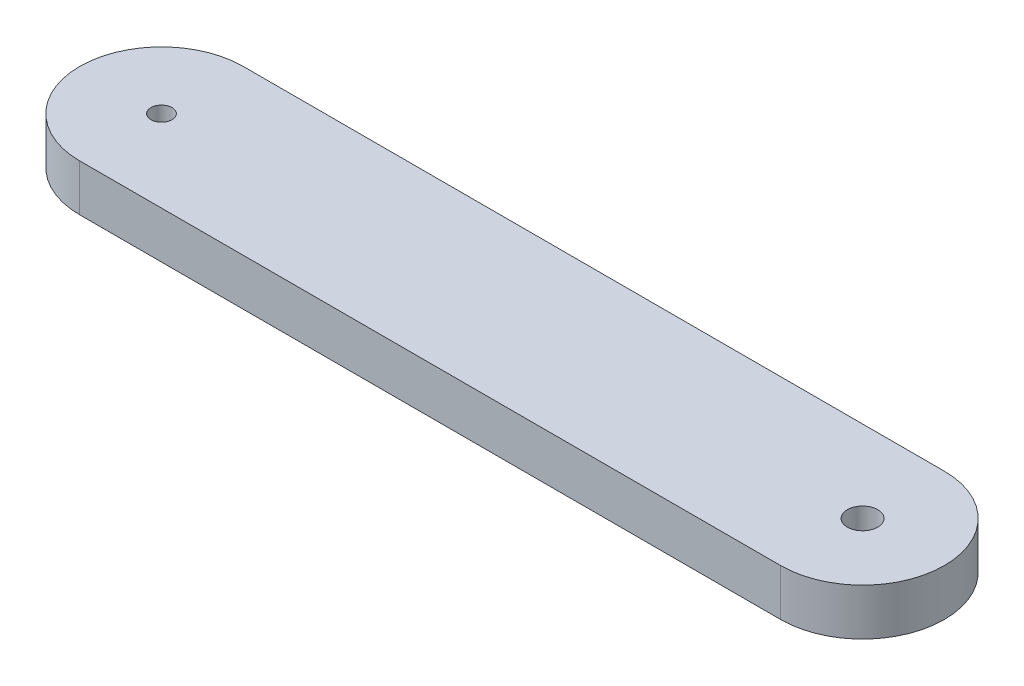
from build123d import *

# Parameters (mm, degrees)
SKETCH1_R           = 2.25
SKETCH1_R_2         = 3.25
BOSS_EXTRUDE1_DEPTH = 10


with BuildPart() as part:
    # Sketch1 → Boss-Extrude1 (new body)
    with BuildSketch(Plane(origin=(0, 0, 0), x_dir=(1, 0, 0), z_dir=(0, 1, 0))):
        with BuildLine():
            Line((0, 17.5), (150, 17.5))
            ThreePointArc((150, 17.5), (167.5, 0), (150, -17.5))
            Line((150, -17.5), (0, -17.5))
            ThreePointArc((0, -17.5), (-17.5, 0), (0, 17.5))
        make_face()
        with Locations(Location((0, 0, 0), (0, 0, 270))):
            Circle(SKETCH1_R, mode=Mode.SUBTRACT)
        with Locations(Location((150, 0, 0), (0, 0, 270))):
            Circle(SKETCH1_R_2, mode=Mode.SUBTRACT)
    extrude(amount=BOSS_EXTRUDE1_DEPTH)


solid = part.part
